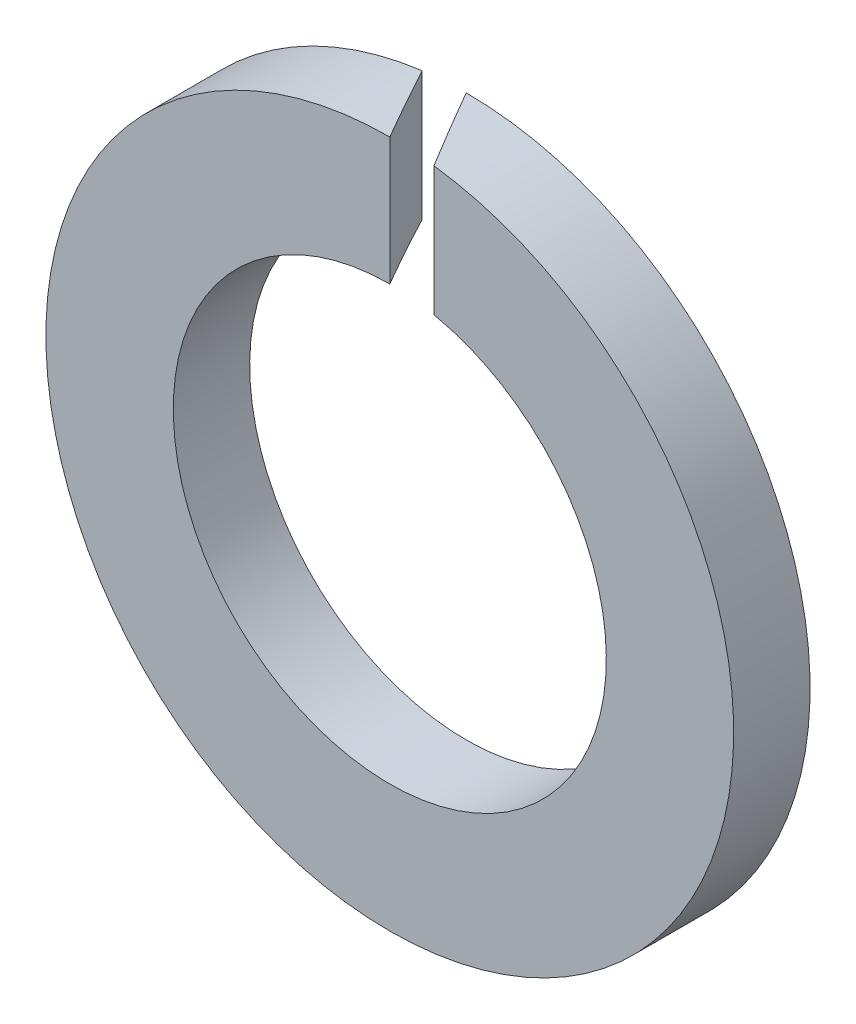
from build123d import *

# Parameters (mm, degrees)
SKETCH1_R          = 2.7
SKETCH1_R_2        = 1.7
BASE_EXTRUDE_DEPTH = 0.6
CUT_EXTRUDE1_DEPTH = 4.865229618


with BuildPart() as part:
    # Sketch1 → Base-Extrude (new body)
    with BuildSketch(Plane.XY):
        Circle(SKETCH1_R)
        Circle(SKETCH1_R_2, mode=Mode.SUBTRACT)
    extrude(amount=-BASE_EXTRUDE_DEPTH)

    # Sketch2 → Cut-Extrude1 (cut, through all)
    with BuildSketch(Plane(origin=(0, 0, 0), x_dir=(1, 0, 0), z_dir=(0, 1, 0))):
        Polygon((0, 0.6), (0.346410162, 0), (0, 0), (-0.346410162, 0.6), align=None)
    extrude(amount=CUT_EXTRUDE1_DEPTH, mode=Mode.SUBTRACT)


solid = part.part
